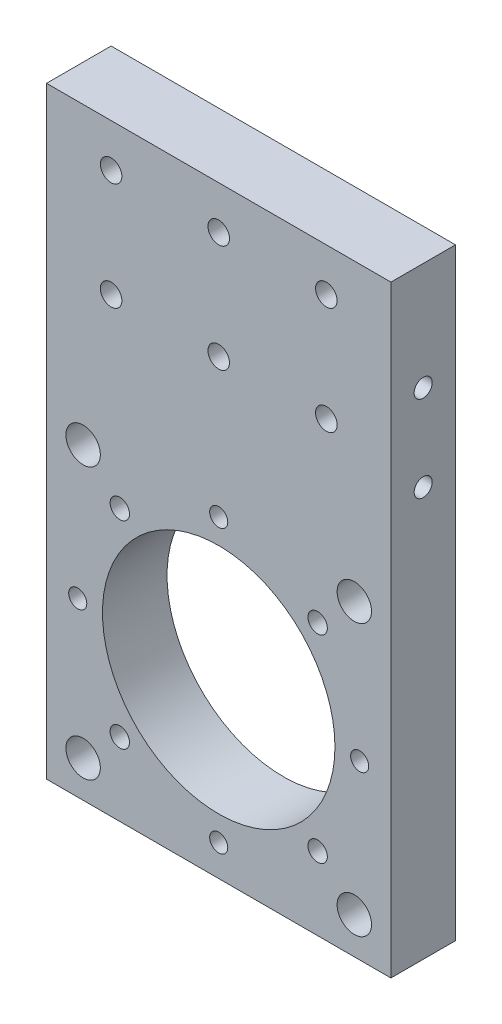
from build123d import *

# Parameters (mm, degrees)
ESQUISSE1_W                                      = 80
ESQUISSE1_H                                      = 80
ESQUISSE1_R                                      = 27
BOSS_EXTRU_1_DEPTH                               = 15
CHAMBRAGE_POUR_VIS_T_TE_CYLINDRIQUE_D            = 4.5
CHAMBRAGE_POUR_VIS_T_TE_CYLINDRIQUE_CBORE_D      = 8
CHAMBRAGE_POUR_VIS_T_TE_CYLINDRIQUE_CBORE_DEPTH  = 7
CHAMBRAGE_POUR_VIS_T_TE_CYLINDRIQU_2_D           = 4.5
CHAMBRAGE_POUR_VIS_T_TE_CYLINDRIQU_2_CBORE_D     = 8
CHAMBRAGE_POUR_VIS_T_TE_CYLINDRIQU_2_CBORE_DEPTH = 7
R_P_TITION_CIRCULAIRE3_COUNT                     = 4
ESQUISSE2_W                                      = 80
ESQUISSE2_H                                      = 60
BOSS_EXTRU_2_DEPTH                               = 15
TROU_TARAUD_PROFOND_M5X0_81_AT_2_COUNT           = 2
TROU_TARAUD_PROFOND_M5X0_81_AT_2_PITCH           = 20
TROU_TARAUD_M6X1_01_D                            = 5
R_P_TITION_LIN_AIRE1_COUNT                       = 2
R_P_TITION_LIN_AIRE1_PITCH                       = 25
TROU_TARAUD_M5X0_81_D                            = 4.2
R_P_TITION_CIRCULAIRE2_COUNT                     = 4


with BuildPart() as part:
    # Esquisse1 → Boss.-Extru.1 (new body)
    with BuildSketch(Plane.XY):
        Rectangle(ESQUISSE1_W, ESQUISSE1_H)
        Circle(ESQUISSE1_R, mode=Mode.SUBTRACT)
    extrude(amount=BOSS_EXTRU_1_DEPTH)

    # Chambrage pour vis _ t_te cylindrique (through all)
    with Locations(Plane(origin=(31.5, 31.5, 15), x_dir=(1, 0, 0), z_dir=(0, 0, 1))):
        with Locations((0, 0)):
            chambrage_pour_vis_t_te_cylindrique = CounterBoreHole(CHAMBRAGE_POUR_VIS_T_TE_CYLINDRIQUE_D / 2, CHAMBRAGE_POUR_VIS_T_TE_CYLINDRIQUE_CBORE_D / 2, CHAMBRAGE_POUR_VIS_T_TE_CYLINDRIQUE_CBORE_DEPTH)

    # Chambrage pour vis _ t_te cylindriqu 2 (through all)
    with Locations(Plane(origin=(22.980970389, 22.980970389, 0), x_dir=(-1, 0, 0), z_dir=(0, 0, -1))):
        with Locations((0, 0)):
            chambrage_pour_vis_t_te_cylindriqu_2 = CounterBoreHole(CHAMBRAGE_POUR_VIS_T_TE_CYLINDRIQU_2_D / 2, CHAMBRAGE_POUR_VIS_T_TE_CYLINDRIQU_2_CBORE_D / 2, CHAMBRAGE_POUR_VIS_T_TE_CYLINDRIQU_2_CBORE_DEPTH)

    # Répétition circulaire3: Chambrage pour vis _ t_te cylindrique, Chambrage pour vis _ t_te cylindriqu 2 ×4 about axis
    r_p_tition_circulaire3_axis = Axis((0, 0, 0), (0, 0, 1))
    add([chambrage_pour_vis_t_te_cylindrique.rotate(r_p_tition_circulaire3_axis, i * 360 / R_P_TITION_CIRCULAIRE3_COUNT) for i in range(1, R_P_TITION_CIRCULAIRE3_COUNT)], mode=Mode.SUBTRACT)
    add([chambrage_pour_vis_t_te_cylindriqu_2.rotate(r_p_tition_circulaire3_axis, i * 360 / R_P_TITION_CIRCULAIRE3_COUNT) for i in range(1, R_P_TITION_CIRCULAIRE3_COUNT)], mode=Mode.SUBTRACT)

    # Esquisse2 → Boss.-Extru.2 (add)
    with BuildSketch(Plane.XY.offset(15)):
        with Locations((0, 70)):
            Rectangle(ESQUISSE2_W, ESQUISSE2_H)
    extrude(amount=-BOSS_EXTRU_2_DEPTH)

    # Esquisse10 → Trou taraudé profond M5x0.81 (revolve, cut)
    with BuildSketch(Plane(origin=(40, 55, 7.5), x_dir=(0, 0, -1), z_dir=(0, 1, 0))):
        Polygon((0, 0), (0, 23.6618073), (2.1, 22.4), (2.1, 0), align=None)
    trou_taraud_profond_m5x0_81 = revolve(axis=Axis((46.35, 55, 7.5), (-1, 0, 0)), mode=Mode.SUBTRACT)

    # Trou taraudé profond M5x0.81 at 2: Trou taraudé profond M5x0.81 ×2
    with Locations(*[(0, i * TROU_TARAUD_PROFOND_M5X0_81_AT_2_PITCH, 0) for i in range(1, TROU_TARAUD_PROFOND_M5X0_81_AT_2_COUNT)]):
        add(trou_taraud_profond_m5x0_81, mode=Mode.SUBTRACT)

    # Symétrie1: Trou taraudé profond M5x0.81 across plane
    add(trou_taraud_profond_m5x0_81.mirror(Plane(origin=(0, 0, 0), x_dir=(0, 0, 1), z_dir=(1, 0, 0))), mode=Mode.SUBTRACT)

    # Symétrie1 copy 1 sketch → Symétrie1 copy 1 (revolve, cut)
    with BuildSketch(Plane(origin=(-40, 75, 7.5), x_dir=(0, 0, -1), z_dir=(0, 1, 0))):
        Polygon((0, 0), (0, -23.6618073), (2.1, -22.4), (2.1, 0), align=None)
    revolve(axis=Axis((-46.35, 75, 7.5), (-1, 0, 0)), mode=Mode.SUBTRACT)

    # Trou taraudé M6x1.01 (through all)
    with Locations(Plane(origin=(-25, 90, 15), x_dir=(1, 0, 0), z_dir=(0, 0, 1))):
        with Locations((0, 0), (25, 0), (50, 0)):
            trou_taraud_m6x1_01 = Hole(TROU_TARAUD_M6X1_01_D / 2)

    # Répétition linéaire1: Trou taraudé M6x1.01 ×2
    with Locations(*[(0, -i * R_P_TITION_LIN_AIRE1_PITCH, 0) for i in range(1, R_P_TITION_LIN_AIRE1_COUNT)]):
        add(trou_taraud_m6x1_01, mode=Mode.SUBTRACT)

    # Trou taraudé M5x0.81 (through all)
    with Locations(Plane(origin=(-32.75, 0, 15), x_dir=(1, 0, 0), z_dir=(0, 0, 1))):
        with Locations((0, 0)):
            trou_taraud_m5x0_81 = Hole(TROU_TARAUD_M5X0_81_D / 2)

    # Répétition circulaire2: Trou taraudé M5x0.81 ×4 about axis
    r_p_tition_circulaire2_axis = Axis((0, 0, 0), (0, 0, 1))
    for i in range(1, R_P_TITION_CIRCULAIRE2_COUNT):
        add(trou_taraud_m5x0_81.rotate(r_p_tition_circulaire2_axis, i * 360 / R_P_TITION_CIRCULAIRE2_COUNT), mode=Mode.SUBTRACT)


solid = part.part
